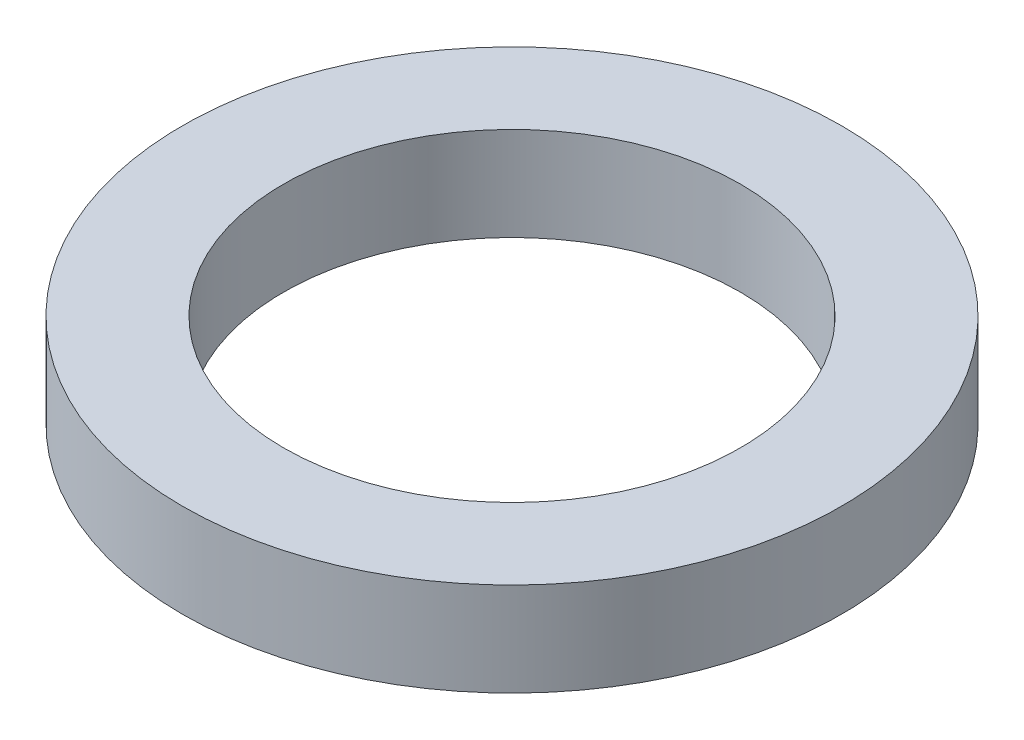
from build123d import *

# Parameters (mm, degrees)
SKETCH1_R           = 44.7167
BOSS_EXTRUDE1_DEPTH = 12.7
CUT_EXTRUDE1_REACH  = 66.502
SKETCH3_R           = 31


with BuildPart() as part:
    # Sketch1 → Boss-Extrude1 (new body)
    with BuildSketch(Plane(origin=(0, 0, 0), x_dir=(1, 0, 0), z_dir=(0, 1, 0))):
        with Locations(Location((0, 0, 0), (0, 0, 270))):
            Circle(SKETCH1_R)
    extrude(amount=BOSS_EXTRUDE1_DEPTH)

    # Sketch3 → Cut-Extrude1 (cut, up to next)
    with BuildSketch(Plane(origin=(0, 0, 0), x_dir=(1, 0, 0), z_dir=(0, 1, 0)), mode=Mode.PRIVATE) as cut_extrude1_sk1:
        with Locations(Location((0, 0, 0), (0, 0, 270))):
            Circle(SKETCH3_R)
    cut_extrude1_tool1 = extrude(cut_extrude1_sk1.sketch, amount=CUT_EXTRUDE1_REACH, mode=Mode.PRIVATE) & part.part
    add(cut_extrude1_tool1.solids().sort_by_distance((0, 0, 0))[0], mode=Mode.SUBTRACT)


solid = part.part
